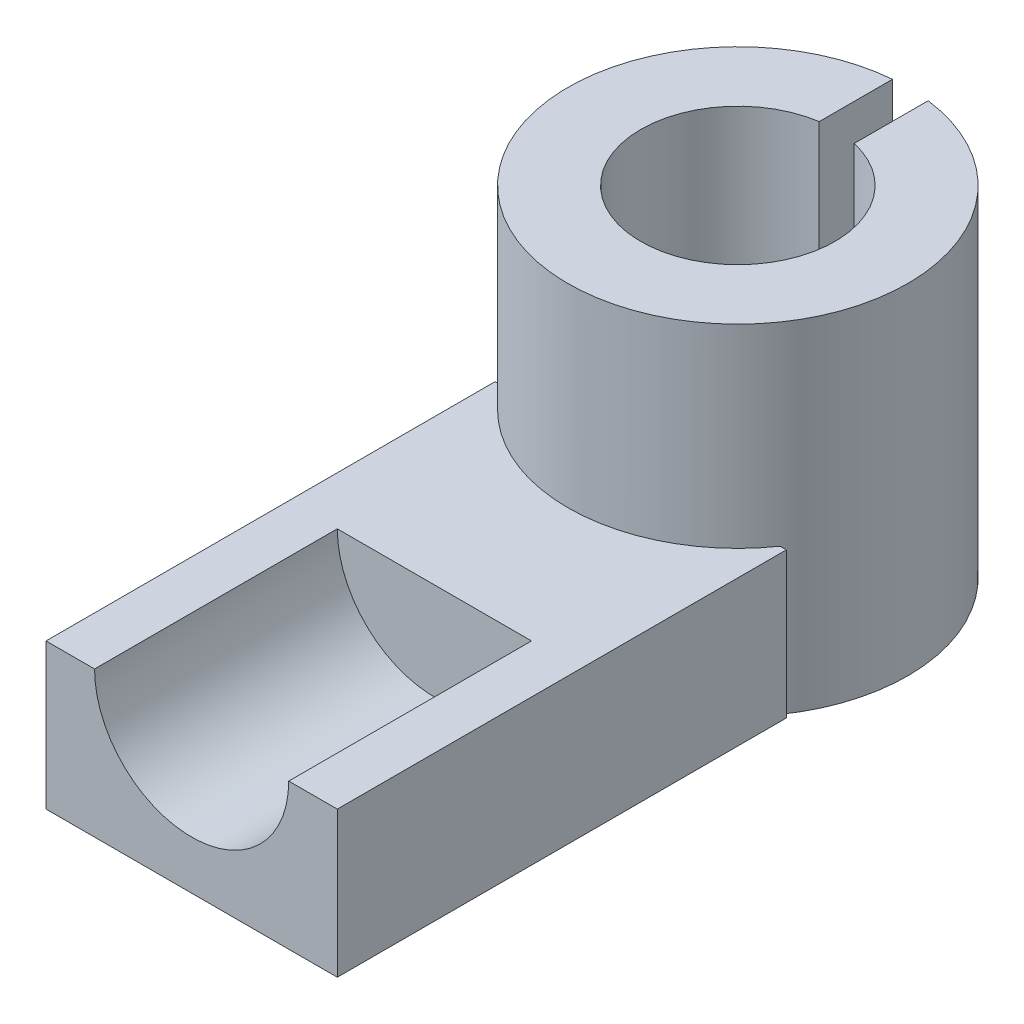
from build123d import *

# Parameters (mm, degrees)
SKETCH1_R               = 28
SKETCH1_R_2             = 16
BOSS_EXTRUDE1_DEPTH     = 56
SKETCH2_W               = 6
SKETCH2_H               = 44.450735801
CUT_EXTRUDE1_DEPTH      = 56
SKETCH3_W               = 48
SKETCH3_H               = 74
BOSS_EXTRUDE2_DEPTH     = 24
CUT_EXTRUDE4_DEPTH      = 134.489909528
CUT_EXTRUDE4_DEPTH_BACK = 40


with BuildPart() as part:
    # Sketch1 → Boss-Extrude1 (new body)
    with BuildSketch(Plane(origin=(0, 0, 0), x_dir=(1, 0, 0), z_dir=(0, 1, 0))):
        with Locations(Location((0, 0, 0), (0, 0, 270))):
            Circle(SKETCH1_R)
        with Locations(Location((0, 0, 0), (0, 0, 270))):
            Circle(SKETCH1_R_2, mode=Mode.SUBTRACT)
    extrude(amount=BOSS_EXTRUDE1_DEPTH)

    # Sketch2 → Cut-Extrude1 (cut)
    with BuildSketch(Plane(origin=(0, 56, 0), x_dir=(1, 0, 0), z_dir=(0, 1, 0))):
        with Locations((0.593322954, 8.717135315)):
            Rectangle(SKETCH2_W, SKETCH2_H)
    extrude(amount=-CUT_EXTRUDE1_DEPTH, mode=Mode.SUBTRACT)

    # Sketch3 → Boss-Extrude2 (add)
    with BuildSketch(Plane.XZ):
        with Locations((0, 53)):
            Rectangle(SKETCH3_W, SKETCH3_H)
    extrude(amount=-BOSS_EXTRUDE2_DEPTH)

    # Sketch4 → Cut-Extrude4 (cut, two sides: drawn at the far end of the back side and taken through both)
    with BuildSketch(Plane.XY.offset(90).offset(-CUT_EXTRUDE4_DEPTH_BACK)):
        with BuildLine():
            Line((-16, 142.81176407), (-16, 24))
            ThreePointArc((-16, 24), (0, 8), (16, 24))
            Line((16, 24), (16, 142.81176407))
            Line((16, 142.81176407), (16, 380.43529221))
            Line((16, 380.43529221), (-16, 380.43529221))
            Line((-16, 380.43529221), (-16, 142.81176407))
        make_face()
    extrude(amount=CUT_EXTRUDE4_DEPTH + CUT_EXTRUDE4_DEPTH_BACK, mode=Mode.SUBTRACT)


solid = part.part
